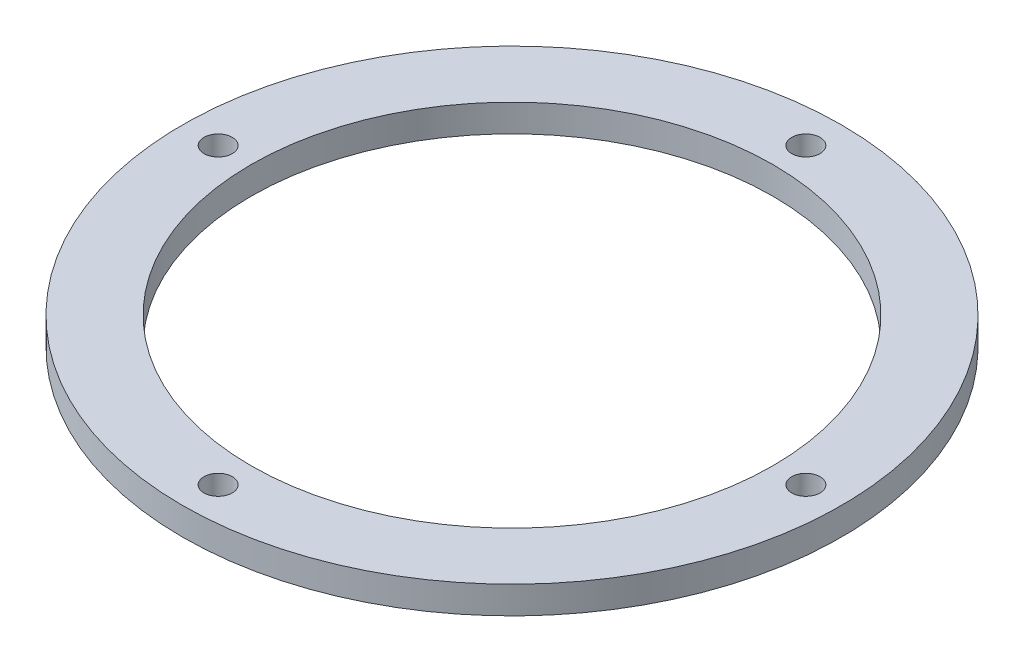
from build123d import *

# Parameters (mm, degrees)
SKETCH_1_R          = 60
SKETCH_1_R_2        = 47.5
EXTRUDE_1_DEPTH     = 5
CUT_EXTRUDE_1_REACH = 87
SKETCH_2_R          = 2.575


with BuildPart() as part:
    # 草图1 → 凸台-拉伸1 (new body)
    with BuildSketch(Plane(origin=(0, 0, 0), x_dir=(1, 0, 0), z_dir=(0, 1, 0))):
        with Locations(Location((0, 0, 0), (0, 0, 270))):
            Circle(SKETCH_1_R)
        with Locations(Location((0, 0, 0), (0, 0, 270))):
            Circle(SKETCH_1_R_2, mode=Mode.SUBTRACT)
    extrude(amount=EXTRUDE_1_DEPTH)

    # 草图2 → 切除-拉伸1 (cut, up to next)
    with BuildSketch(Plane(origin=(0, 5, 0), x_dir=(1, 0, 0), z_dir=(0, 1, 0)), mode=Mode.PRIVATE) as cut_extrude_1_sk1:
        with Locations(Location((0, 53.5, 0), (0, 0, 270))):
            Circle(SKETCH_2_R)
    cut_extrude_1_tool1 = extrude(cut_extrude_1_sk1.sketch, amount=-CUT_EXTRUDE_1_REACH, mode=Mode.PRIVATE) & part.part
    # 草图2 → 切除-拉伸1 (cut, up to next)
    with BuildSketch(Plane(origin=(0, 5, 0), x_dir=(1, 0, 0), z_dir=(0, 1, 0)), mode=Mode.PRIVATE) as cut_extrude_1_sk2:
        with Locations(Location((53.5, 0, 0), (0, 0, 270))):
            Circle(SKETCH_2_R)
    cut_extrude_1_tool2 = extrude(cut_extrude_1_sk2.sketch, amount=-CUT_EXTRUDE_1_REACH, mode=Mode.PRIVATE) & part.part
    # 草图2 → 切除-拉伸1 (cut, up to next)
    with BuildSketch(Plane(origin=(0, 5, 0), x_dir=(1, 0, 0), z_dir=(0, 1, 0)), mode=Mode.PRIVATE) as cut_extrude_1_sk3:
        with Locations(Location((0, -53.5, 0), (0, 0, 270))):
            Circle(SKETCH_2_R)
    cut_extrude_1_tool3 = extrude(cut_extrude_1_sk3.sketch, amount=-CUT_EXTRUDE_1_REACH, mode=Mode.PRIVATE) & part.part
    # 草图2 → 切除-拉伸1 (cut, up to next)
    with BuildSketch(Plane(origin=(0, 5, 0), x_dir=(1, 0, 0), z_dir=(0, 1, 0)), mode=Mode.PRIVATE) as cut_extrude_1_sk4:
        with Locations(Location((-53.5, 0, 0), (0, 0, 270))):
            Circle(SKETCH_2_R)
    cut_extrude_1_tool4 = extrude(cut_extrude_1_sk4.sketch, amount=-CUT_EXTRUDE_1_REACH, mode=Mode.PRIVATE) & part.part
    add(cut_extrude_1_tool1.solids().sort_by_distance((0, 5, -53.5))[0], mode=Mode.SUBTRACT)
    add(cut_extrude_1_tool2.solids().sort_by_distance((53.5, 5, 0))[0], mode=Mode.SUBTRACT)
    add(cut_extrude_1_tool3.solids().sort_by_distance((0, 5, 53.5))[0], mode=Mode.SUBTRACT)
    add(cut_extrude_1_tool4.solids().sort_by_distance((-53.5, 5, 0))[0], mode=Mode.SUBTRACT)


solid = part.part
